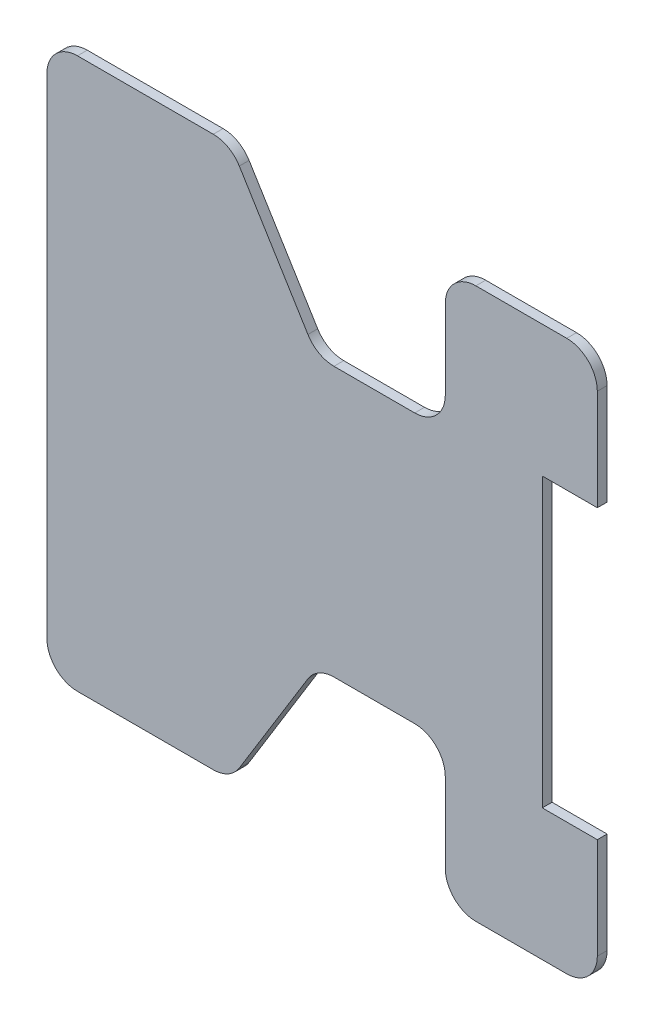
from build123d import *

# Parameters (mm, degrees)
BOSS_EXTRUDE1_DEPTH = 1.6
SKETCH2_OUTSIDE_W   = 117.458
SKETCH2_OUTSIDE_H   = 117.458
CUT_EXTRUDE1_DEPTH  = 128.289276846
FILLET2_R           = 5


with BuildPart() as part:
    # Sketch1 → Boss-Extrude1 (new body)
    with BuildSketch(Plane.XY):
        Polygon((90, 68.5), (90, 90), (0, 90), (0, 0), (90, 0), (90, 21.5), (81, 21.5), (81, 68.5), align=None)
    extrude(amount=BOSS_EXTRUDE1_DEPTH)

    # Sketch2 outside → Cut-Extrude1 (cut, through all)
    with BuildSketch(Plane.XY.offset(1.6)):
        with Locations((45, 45)):
            Rectangle(SKETCH2_OUTSIDE_W, SKETCH2_OUTSIDE_H)
        Polygon((0, 90), (30, 90), (44.142135624, 67), (65.142135624, 67), (65.142135624, 90), (90, 90), (90, 68.5), (81, 68.5), (81, 21.5), (90, 21.5), (90, 0), (65.142135624, 0), (65.142135624, 23), (44.142135624, 23), (30, 0), (0, 0), align=None, mode=Mode.SUBTRACT)
    extrude(amount=-CUT_EXTRUDE1_DEPTH, mode=Mode.SUBTRACT)

    # Fillet2
    fillet2_edges = [part.edges().sort_by_distance(p)[0] for p in [
        (0, 90, 0.8),
        (90, 90, 0.8),
        (90, 0, 0.8),
        (0, 0, 0.8),
        (30, 90, 0.8),
        (44.142135624, 67, 0.8),
        (65.142135624, 67, 0.8),
        (65.142135624, 90, 0.8),
        (65.142135624, 0, 0.8),
        (65.142135624, 23, 0.8),
        (44.142135624, 23, 0.8),
        (30, 0, 0.8),
    ]]
    fillet(fillet2_edges, radius=FILLET2_R)


solid = part.part
